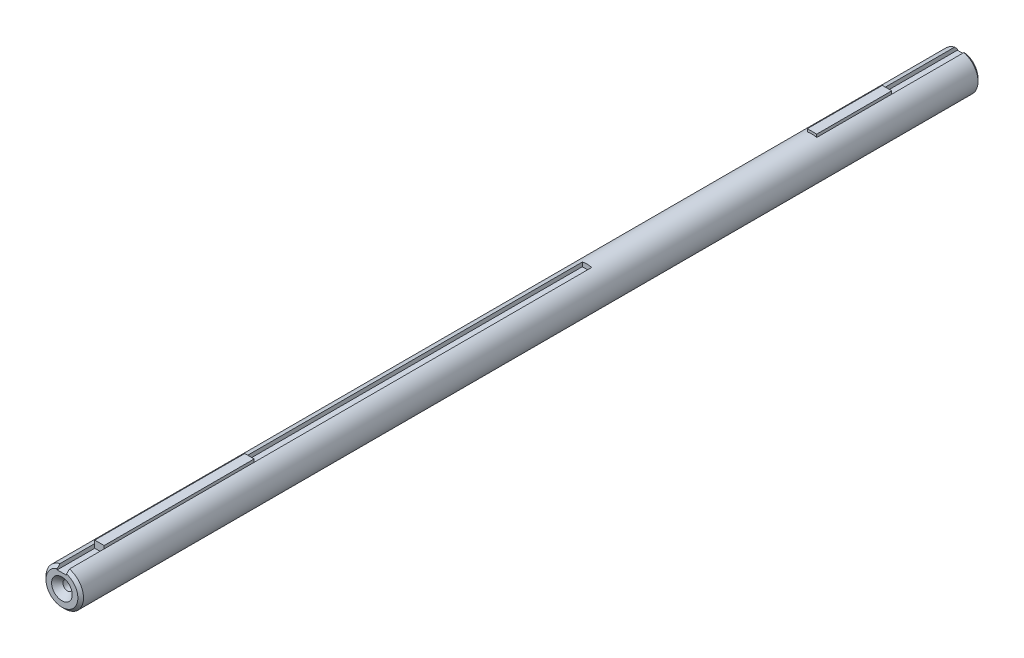
from build123d import *

# Parameters (mm, degrees)
SKETCH1_R           = 12.7
EXTRUDE1_DEPTH      = 304.8
CHAMFER1_SIZE       = 1.905
EXTRUDE2_DEPTH      = 306.328708116
EXTRUDE2_DEPTH_BACK = 306.328708116
SKETCH3_W           = 6.35
SKETCH3_H           = 3.175
EXTRUDE3_START      = -203.2
SKETCH1_2_R         = 12.7
EXTRUDE3_DEPTH      = 152.4
SKETCH5_W           = 6.35
SKETCH5_H           = 4.7625
EXTRUDE4_DEPTH      = 50.8
SKETCH6_W           = 6.35
SKETCH6_H           = 4.7625
EXTRUDE5_DEPTH      = 25.4
SKETCH7_R           = 3.175
CUT_EXTRUDE1_DEPTH  = 12.7
CUT_EXTRUDE2_START  = -12.7
SKETCH8_R           = 3.175
CUT_EXTRUDE2_DEPTH  = 12.7
CHAMFER2_SIZE       = 3.81


with BuildPart() as part:
    # Sketch1 → Extrude1 (new, symmetric)
    with BuildSketch(Plane.XY):
        with Locations(Location((0, 0, 0), (0, 0, 180))):
            Circle(SKETCH1_R)
    extrude(amount=EXTRUDE1_DEPTH, both=True)

    # Chamfer1
    chamfer1_edges = [part.edges().sort_by_distance(p)[0] for p in [
        (12.7, 0, -304.8),
        (12.7, 0, 304.8),
    ]]
    chamfer(chamfer1_edges, length=CHAMFER1_SIZE)

    # Sketch3 → Extrude2 (cut, two sides: drawn at the far end of the back side and taken through both)
    with BuildSketch(Plane.XY.offset(-EXTRUDE2_DEPTH_BACK)):
        with Locations((0, 11.1125)):
            Rectangle(SKETCH3_W, SKETCH3_H)
    extrude(amount=EXTRUDE2_DEPTH + EXTRUDE2_DEPTH_BACK, mode=Mode.SUBTRACT)

    # Sketch1<2> → Extrude3 (add)
    with BuildSketch(Plane.XY.offset(EXTRUDE3_START)):
        with Locations(Location((0, 0, 0), (0, 0, 104.477512186))):
            Circle(SKETCH1_2_R)
    extrude(amount=EXTRUDE3_DEPTH)

    # Sketch7 → Cut-Extrude1 (cut)
    with BuildSketch(Plane.XY.offset(304.8)):
        Circle(SKETCH7_R)
    extrude(amount=-CUT_EXTRUDE1_DEPTH, mode=Mode.SUBTRACT)

    # Sketch8 → Cut-Extrude2 (cut)
    with BuildSketch(Plane(origin=(0, 0, -304.8), x_dir=(-1, 0, 0), z_dir=(0, 0, -1)).offset(CUT_EXTRUDE2_START)):
        with Locations(Location((0, 0, 0), (0, 0, 180))):
            Circle(SKETCH8_R)
    extrude(amount=CUT_EXTRUDE2_DEPTH, mode=Mode.SUBTRACT)

    # Chamfer2
    chamfer2_edges = [part.edges().sort_by_distance(p)[0] for p in [
        (-3.175, 0, 304.8),
        (-3.175, 0, -304.8),
    ]]
    chamfer(chamfer2_edges, length=CHAMFER2_SIZE)


with BuildPart() as body_2:
    # Sketch5 → Extrude4 (new, symmetric)
    with BuildSketch(Plane.XY.offset(228.6)):
        with Locations((0, 11.90625)):
            Rectangle(SKETCH5_W, SKETCH5_H)
    extrude(amount=EXTRUDE4_DEPTH, both=True)


with BuildPart() as body_3:
    # Sketch6 → Extrude5 (new, symmetric)
    with BuildSketch(Plane(origin=(0, 0, -228.6), x_dir=(-1, 0, 0), z_dir=(0, 0, -1))):
        with Locations((0, 11.90625)):
            Rectangle(SKETCH6_W, SKETCH6_H)
    extrude(amount=EXTRUDE5_DEPTH, both=True)


solid = Compound([part.part, body_2.part, body_3.part])
